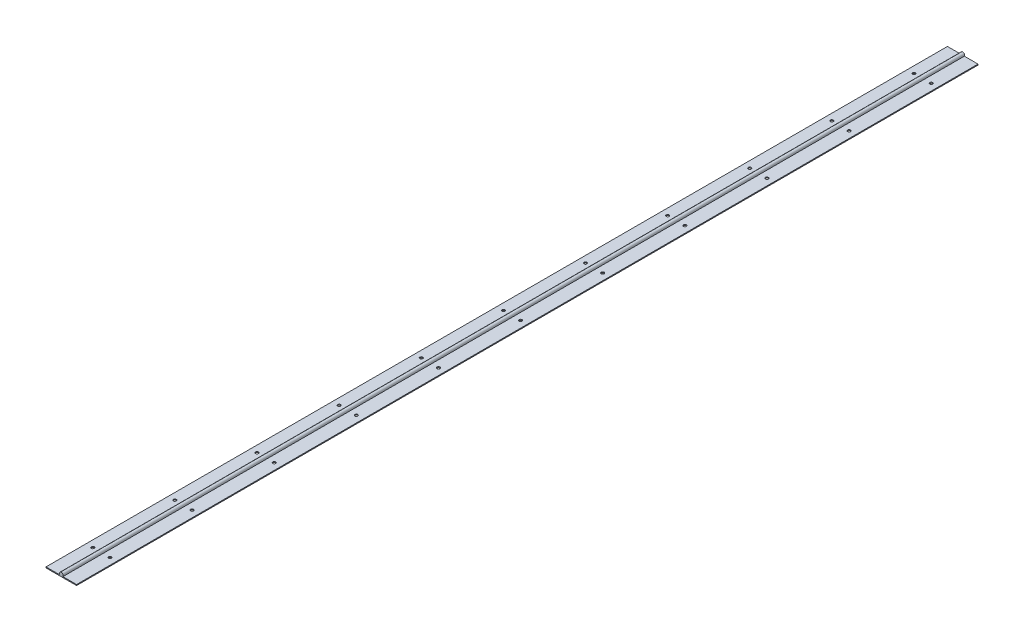
from build123d import *

# Parameters (mm, degrees)
EXTRUDE1_DEPTH     = 1498.6
SKETCH2_R          = 2.4257
CUT_EXTRUDE1_DEPTH = 1499.828690178
LPATTERN1_COUNT    = 11
LPATTERN1_PITCH    = 136.525


with BuildPart() as part:
    # Sketch1 → Extrude1 (new body)
    with BuildSketch(Plane.XY):
        with BuildLine():
            Line((-25.4, 0), (25.4, 0))
            Line((25.4, 0), (25.4, 1.524))
            Line((25.4, 1.524), (2.711977876, 1.524))
            ThreePointArc((2.711977876, 1.524), (0, 6.35), (-2.711977876, 1.524))
            Line((-2.711977876, 1.524), (-25.4, 1.524))
            Line((-25.4, 1.524), (-25.4, 0))
        make_face()
    extrude(amount=-EXTRUDE1_DEPTH)

    # Sketch2 → Cut-Extrude1 (cut, through all)
    with BuildSketch(Plane(origin=(0, 0, 0), x_dir=(1, 0, 0), z_dir=(0, 1, 0))):
        with Locations(Location((14.3002, 66.675, 0), (0, 0, 180))):
            Circle(SKETCH2_R)
        with Locations(Location((-14.3002, 66.675, 0), (0, 0, 180))):
            Circle(SKETCH2_R)
    cut_extrude1 = extrude(amount=CUT_EXTRUDE1_DEPTH, mode=Mode.SUBTRACT)

    # LPattern1: Cut-Extrude1 ×11
    with Locations(*[(0, 0, -i * LPATTERN1_PITCH) for i in range(1, LPATTERN1_COUNT)]):
        add(cut_extrude1, mode=Mode.SUBTRACT)


solid = part.part
